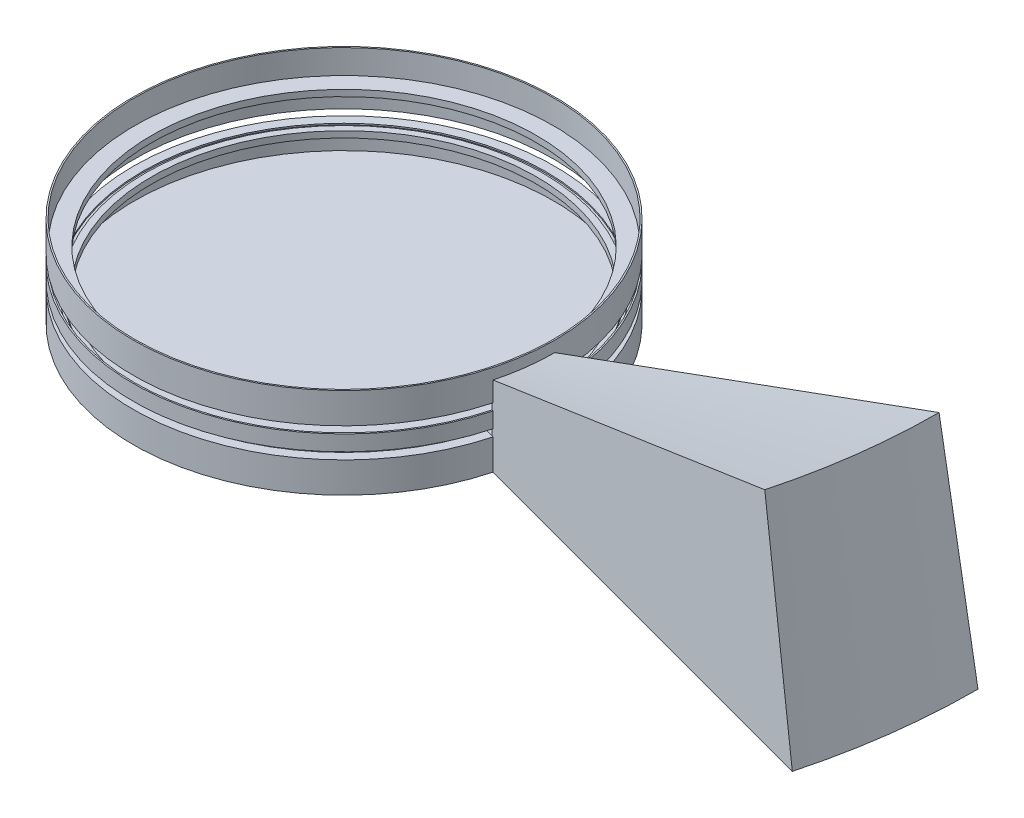
from build123d import *
from build123d.topology import SkipClean

# Parameters (mm, degrees)
SKETCH1_R           = 300
SKETCH1_R_2         = 298
BOSS_EXTRUDE2_DEPTH = 127
BOSS_EXTRUDE3_START = -2
SKETCH2_R           = 300
BOSS_EXTRUDE3_DEPTH = 2
SKETCH3_W           = 300
SKETCH3_H           = 10
SKETCH3_W_2         = 317.252583451
CUT_REVOLVE2_ANGLE  = 345
REVOLVE_THIN1_ANGLE = 15
REVOLVE4_ANGLE      = 0.127
SKETCH9_W           = 300
SKETCH9_H           = 10
CUT_REVOLVE4_ANGLE  = 13.5
CUT_REVOLVE5_ANGLE  = 15
REVOLVE6_ANGLE      = 10


with BuildPart() as part:
    # Sketch1 → Boss-Extrude2 (new body)
    with BuildSketch(Plane(origin=(0, 0, 0), x_dir=(1, 0, 0), z_dir=(0, 1, 0))):
        with Locations(Location((0, 0, 0), (0, 0, 270))):
            Circle(SKETCH1_R)
        with Locations(Location((0, 0, 0), (0, 0, 270))):
            Circle(SKETCH1_R_2, mode=Mode.SUBTRACT)
    extrude(amount=BOSS_EXTRUDE2_DEPTH)

    # Sketch2 → Boss-Extrude3 (add)
    with BuildSketch(Plane(origin=(0, 0, 0), x_dir=(1, 0, 0), z_dir=(0, 1, 0)).offset(BOSS_EXTRUDE3_START)):
        with Locations(Location((0, 0, 0), (0, 0, 270))):
            Circle(SKETCH2_R)
    extrude(amount=BOSS_EXTRUDE3_DEPTH)

    # Sketch3 → Cut-Revolve2 (revolve, cut)
    with BuildSketch(Plane.XY):
        with Locations((150, 46.5)):
            Rectangle(SKETCH3_W, SKETCH3_H)
        with Locations((158.626291726, 78.5)):
            Rectangle(SKETCH3_W_2, SKETCH3_H)
    revolve(axis=Axis((0, 73.5, 0), (0, 1, 0)), revolution_arc=CUT_REVOLVE2_ANGLE, mode=Mode.SUBTRACT)

    # Sketch4 → Revolve-Thin1 (revolve)
    with BuildSketch(Plane.XY):
        Polygon((300, 109.517558015), (845.427262994, 308.630431076), (900, 0), (300, 0), (300, -2), (902.384670038, -2), (846.981489884, 311.326915818), (299.314154598, 111.396285267), align=None)
    revolve(axis=Axis((0, -2, 0), (0, -1, 0)), revolution_arc=REVOLVE_THIN1_ANGLE)

    # Sketch8 → Revolve4 (revolve)
    with BuildSketch(Plane(origin=(0, 0, 0), x_dir=(0.9659258262890682, 0, 0.25881904510252135), z_dir=(-0.2588190451025213, 0, 0.9659258262890681))):
        Polygon((300, 109.517558015), (300, 0), (900, 0), (845.427262994, 308.630431076), align=None)
    revolve(axis=Axis((0, 0, 0), (0, 1, 0)), revolution_arc=REVOLVE4_ANGLE)

    # Sketch9 → Cut-Revolve4 (revolve, cut)
    with BuildSketch(Plane.XY):
        Polygon((300, 41.5), (298, 41.5), (0, 41.5), (0, 51.5), (300, 51.5), align=None)
        with Locations((150, 78.5)):
            Rectangle(SKETCH9_W, SKETCH9_H)
    revolve(axis=Axis((0, 0, 0), (0, -1, 0)), revolution_arc=CUT_REVOLVE4_ANGLE, mode=Mode.SUBTRACT)

    # Sketch12 → Revolve5 (revolve)
    with BuildSketch(Plane.XY, mode=Mode.PRIVATE) as revolve5_sk:
        Polygon((298, 83.5), (298, 92.5), (274, 92.5), (274, 83.5), (285, 83.5), (285, 85.5), (276, 85.5), (276, 90.5), (296, 90.5), (296, 85.5), (289, 85.5), (289, 83.5), align=None)
        Polygon((276, 39.5), (276, 34.5), (296, 34.5), (296, 39.5), (287, 39.5), (287, 41.5), (298, 41.5), (298, 32.5), (274, 32.5), (274, 41.5), (283, 41.5), (283, 39.5), align=None)
    revolve(revolve5_sk.sketch.rotate(Axis((0, 0, 0), (0, 1, 0)), 90), axis=Axis((0, 0, 0), (0, 1, 0)))

    # Sketch14 → Cut-Revolve5 (revolve, cut)
    with SkipClean():  # the faces are left unmerged after this step: merging them gives an invalid solid
        with BuildSketch(Plane.XY):
            Polygon((0, 127), (0, 85.51346858), (0, 6.840131268), (298, 6.840131268), (298, 127), align=None)
        revolve(axis=Axis((0, 6.840131268, 0), (0, -1, 0)), revolution_arc=CUT_REVOLVE5_ANGLE, mode=Mode.SUBTRACT)

    # Sketch15 → Revolve6 (revolve)
    with BuildSketch(Plane.XY):
        Polygon((289, 83.5), (298, 83.5), (298, 92.5), (274, 92.5), (274, 83.5), (285, 83.5), (285, 85.5), (276, 85.5), (276, 90.5), (296, 90.5), (296, 85.5), (289, 85.5), align=None)
        Polygon((287, 41.5), (298, 41.5), (298, 32.5), (274, 32.5), (274, 41.5), (283, 41.5), (283, 39.5), (276, 39.5), (276, 34.5), (296, 34.5), (296, 39.5), (287, 39.5), align=None)
    revolve(axis=Axis((0, 0, 0), (0, -1, 0)), revolution_arc=REVOLVE6_ANGLE)


solid = part.part
